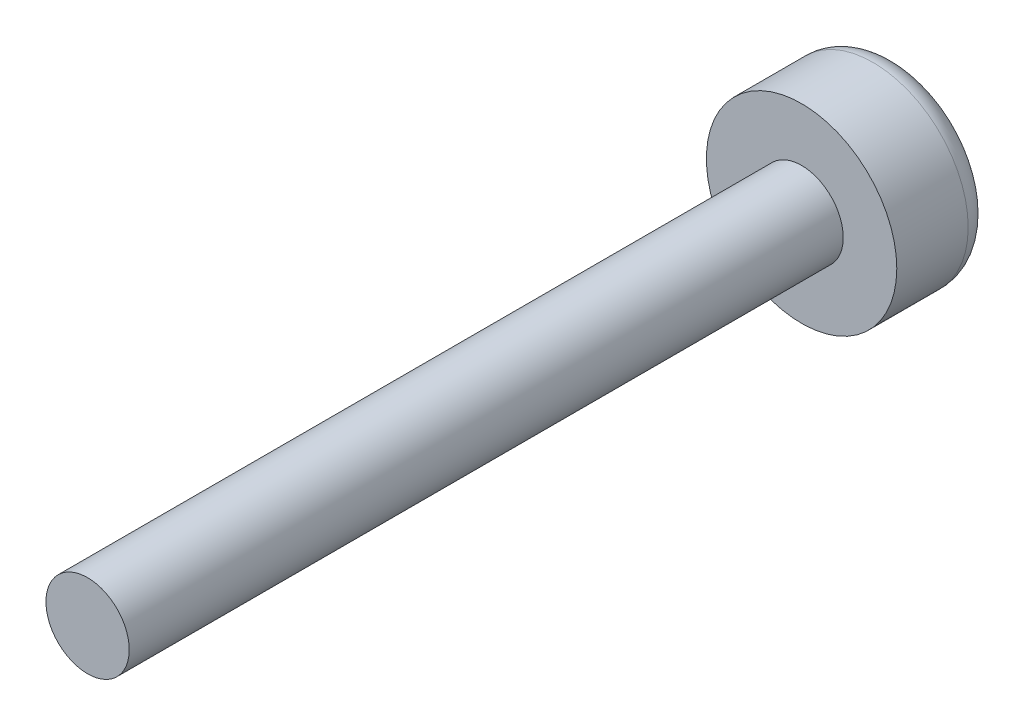
from build123d import *

# Parameters (mm, degrees)
CROQUIS1_R              = 4
SALIENTE_EXTRUIR1_DEPTH = 4
CROQUIS2_R              = 1.75
SALIENTE_EXTRUIR2_DEPTH = 30
REDONDEO2_R             = 1


with BuildPart() as part:
    # Croquis1 → Saliente-Extruir1 (new body)
    with BuildSketch(Plane.XY):
        Circle(CROQUIS1_R)
    extrude(amount=SALIENTE_EXTRUIR1_DEPTH)

    # Croquis2 → Saliente-Extruir2 (add)
    with BuildSketch(Plane.XY.offset(4)):
        Circle(CROQUIS2_R)
    extrude(amount=SALIENTE_EXTRUIR2_DEPTH)

    # Redondeo2
    redondeo2_edges = [part.edges().sort_by_distance(p)[0] for p in [
        (-4, 0, 0),
    ]]
    fillet(redondeo2_edges, radius=REDONDEO2_R)


solid = part.part
